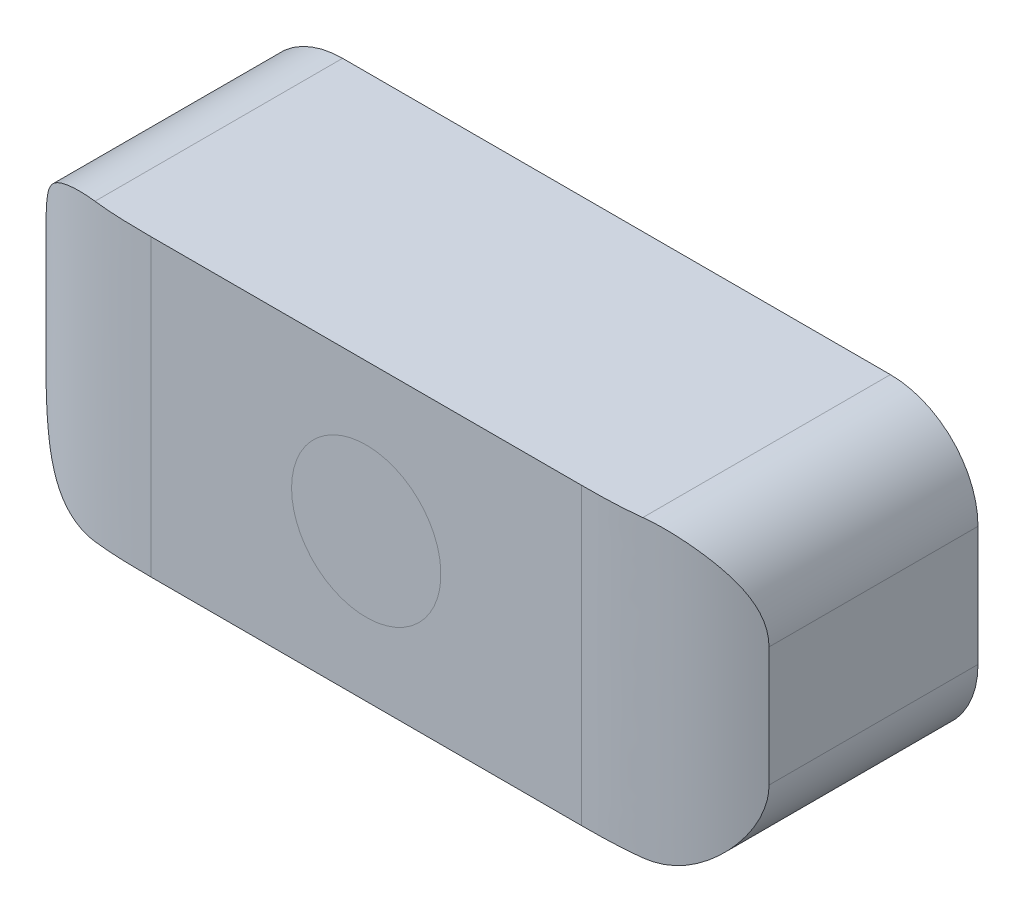
from build123d import *

# Parameters (mm, degrees)
SKETCH1_W           = 28.575
SKETCH1_H           = 33.655
BOSS_EXTRUDE1_DEPTH = 41.275
FILLET1_R           = 10
CUT_EXTRUDE2_DEPTH  = 56.139979201


with BuildPart() as part:
    # Sketch1 → Boss-Extrude1 (new, symmetric)
    with BuildSketch(Plane(origin=(0, 0, 0), x_dir=(0, 0, -1), z_dir=(1, 0, 0))):
        Rectangle(SKETCH1_W, SKETCH1_H)
    extrude(amount=BOSS_EXTRUDE1_DEPTH, both=True)

    # Fillet1
    fillet1_edges = [part.edges().sort_by_distance(p)[0] for p in [
        (41.275, 16.8275, 0),
        (-41.275, 16.8275, 0),
        (-41.275, -16.8275, 0),
        (41.275, -16.8275, 0),
    ]]
    fillet(fillet1_edges, radius=FILLET1_R)

    # Sketch2 → Cut-Extrude2 (cut, through all)
    with BuildSketch(Plane(origin=(0, 16.8275, 0), x_dir=(1, 0, 0), z_dir=(0, 1, 0))):
        with BuildLine():
            Line((-41.275, -9.573739396), (-47.491413454, -9.573739396))
            Line((-47.491413454, -9.573739396), (-47.491413454, -17.62428107))
            Line((-47.491413454, -17.62428107), (-24.575362808, -17.62428107))
            Line((-24.575362808, -17.62428107), (-24.575362808, -14.2875))
            add(Edge.make_bspline(
                [(-41.275, -9.573739396), (-36.608413477, -13.610536753), (-32.538276189, -14.2875), (-24.575362808, -14.2875)],
                knots=[0, 0, 0, 0, 1, 1, 1, 1], degree=3))
        make_face()
        with BuildLine():
            Line((24.575362808, -17.62428107), (24.575362808, -14.2875))
            add(Edge.make_bspline(
                [(41.275, -9.573739396), (36.608413477, -13.610536753), (32.538276189, -14.2875), (24.575362808, -14.2875)],
                knots=[0, 0, 0, 0, 1, 1, 1, 1], degree=3))
            Line((41.275, -9.573739396), (47.491413454, -9.573739396))
            Line((47.491413454, -9.573739396), (47.491413454, -17.62428107))
            Line((47.491413454, -17.62428107), (24.575362808, -17.62428107))
        make_face()
    extrude(amount=-CUT_EXTRUDE2_DEPTH, mode=Mode.SUBTRACT)


solid = part.part
